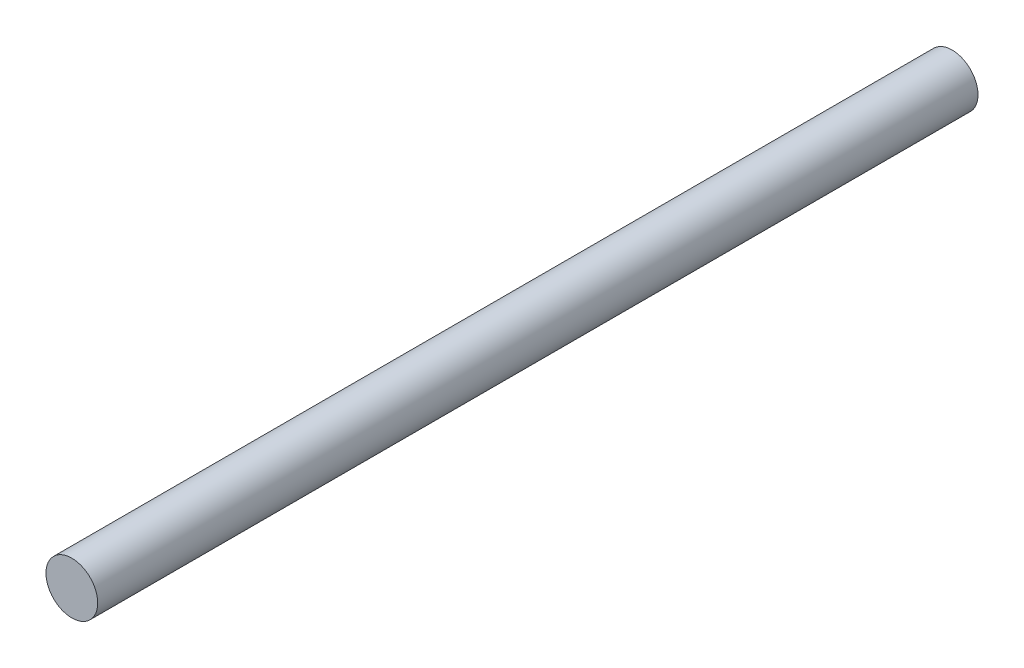
from build123d import *

# Parameters (mm, degrees)
SKETCH1_R           = 1.5875
BOSS_EXTRUDE1_DEPTH = 53.975


with BuildPart() as part:
    # Sketch1 → Boss-Extrude1 (new body)
    with BuildSketch(Plane.XY):
        Circle(SKETCH1_R)
    extrude(amount=BOSS_EXTRUDE1_DEPTH)


solid = part.part
